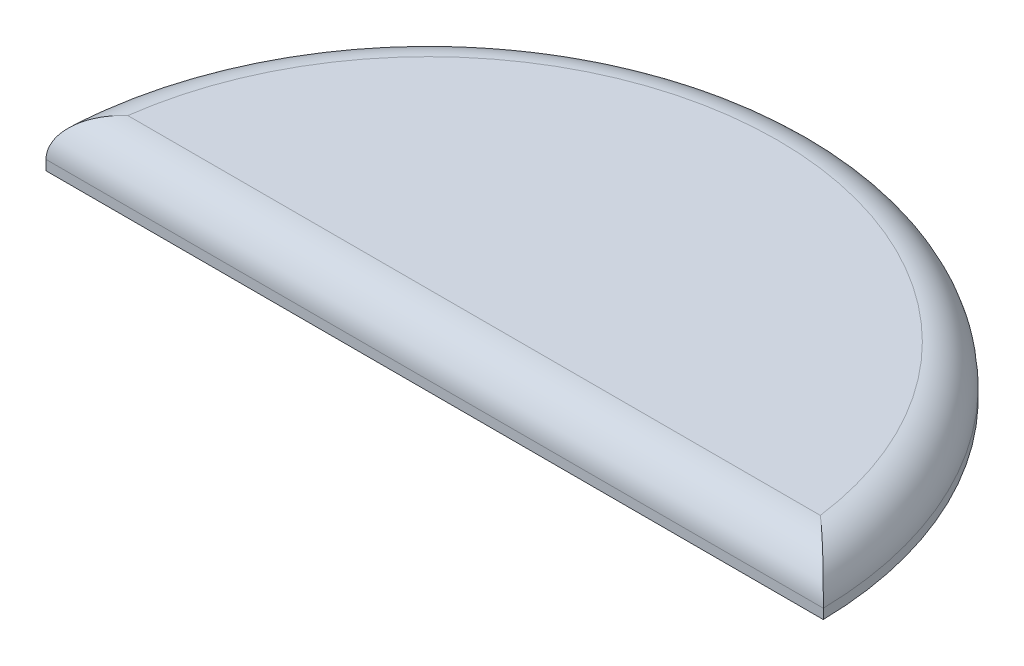
from build123d import *

# Parameters (mm, degrees)
BOSS_EXTRUDE1_DEPTH = 5
FILLET1_R           = 4


with BuildPart() as part:
    # Sketch1 → Boss-Extrude1 (new body)
    with BuildSketch(Plane(origin=(0, 0, 0), x_dir=(1, 0, 0), z_dir=(0, 1, 0))):
        with BuildLine():
            Line((-41.985543478, 0), (36.844456522, 0))
            ThreePointArc((36.844456522, 0), (-2.570543478, 38.792166423), (-41.985543478, 0))
        make_face()
    extrude(amount=BOSS_EXTRUDE1_DEPTH)

    # Fillet1
    fillet1_edges = [part.edges().sort_by_distance(p)[0] for p in [
        (-2.570543478, 5, -38.792166423),
        (-2.570543478, 5, 0),
    ]]
    fillet(fillet1_edges, radius=FILLET1_R)


solid = part.part
